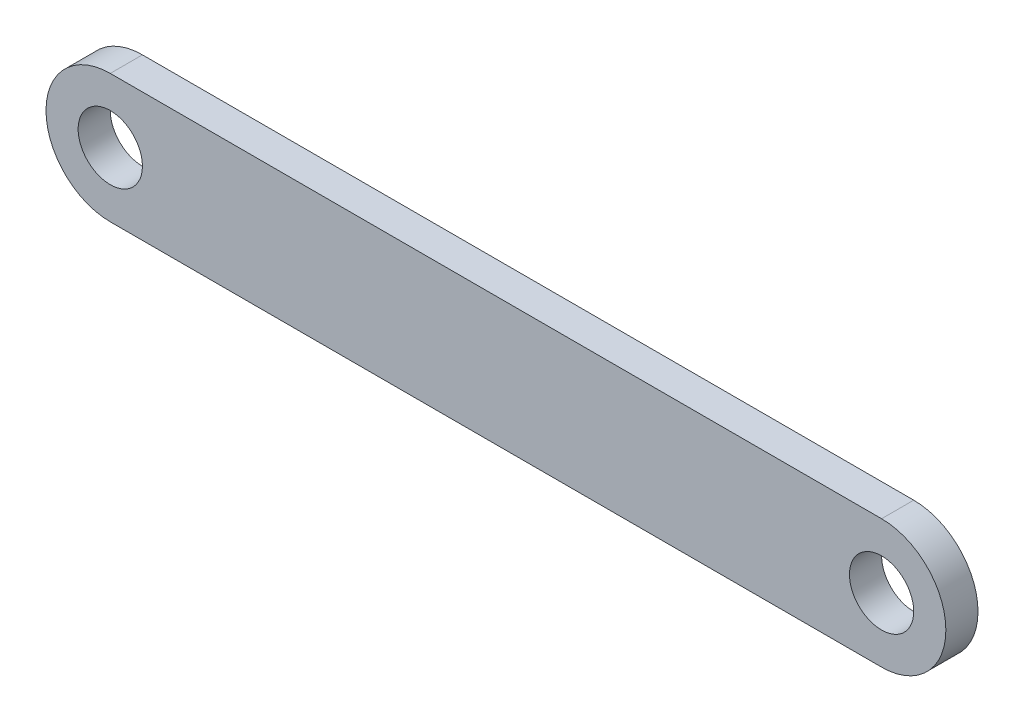
from build123d import *

# Parameters (mm, degrees)
BOSS_EXTRUDE1_DEPTH = 31.75
SKETCH2_R           = 31.75
CUT_EXTRUDE1_DEPTH  = 451.133938401


with BuildPart() as part:
    # Sketch1 → Boss-Extrude1 (new body)
    with BuildSketch(Plane.XY):
        with BuildLine():
            Line((-381, 63.5), (381, 63.5))
            ThreePointArc((381, 63.5), (444.5, 0), (381, -63.5))
            Line((381, -63.5), (-381, -63.5))
            ThreePointArc((-381, -63.5), (-444.5, 0), (-381, 63.5))
        make_face()
    extrude(amount=BOSS_EXTRUDE1_DEPTH)

    # Sketch2 → Cut-Extrude1 (cut, through all)
    with BuildSketch(Plane.XY.offset(31.75)):
        with Locations((-381, 0)):
            Circle(SKETCH2_R)
        with Locations((381, 0)):
            Circle(SKETCH2_R)
    extrude(amount=-CUT_EXTRUDE1_DEPTH, mode=Mode.SUBTRACT)


solid = part.part
